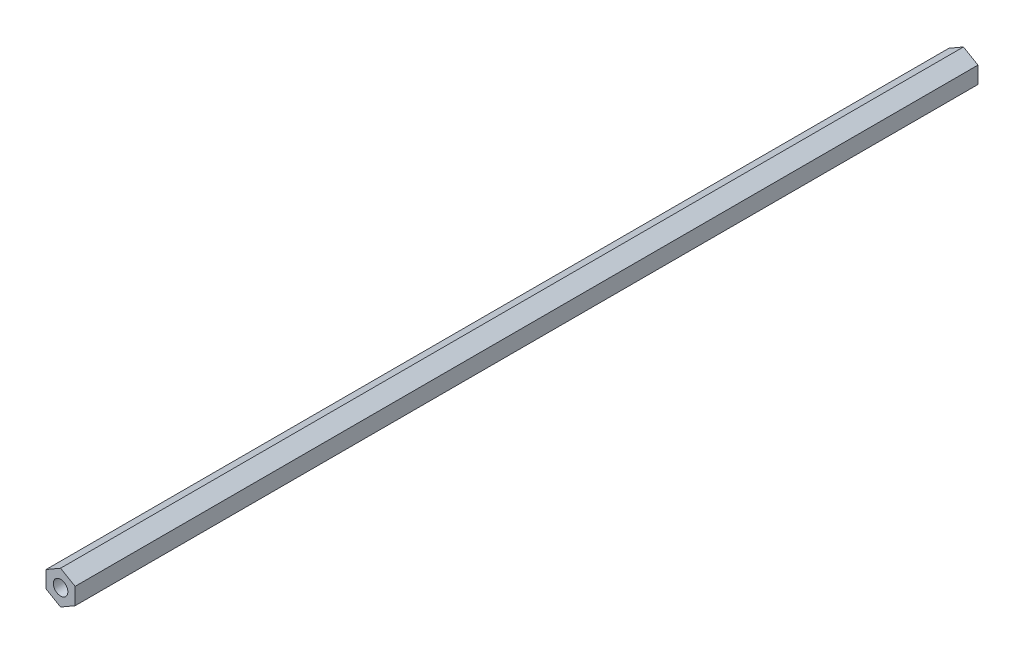
from build123d import *

# Parameters (mm, degrees)
BOSS_EXTRUDE2_DEPTH             = 196.85
BOSS_EXTRUDE2_DEPTH_BACK        = 196.85
F_1_4_0_25_DIAMETER_HOLE1_D     = 6.35
F_1_4_0_25_DIAMETER_HOLE1_DEPTH = 25.4
F_1_4_0_25_DIAMETER_HOLE1_TIP   = 1.907732465
F_1_4_0_25_DIAMETER_HOLE2_D     = 6.35
F_1_4_0_25_DIAMETER_HOLE2_DEPTH = 25.4
F_1_4_0_25_DIAMETER_HOLE2_TIP   = 1.907732465


with BuildPart() as part:
    # Sketch3 → Boss-Extrude2 (new, two sides: drawn at the far end of the back side and taken through both)
    with BuildSketch(Plane.XY.offset(-BOSS_EXTRUDE2_DEPTH_BACK)):
        Polygon((-6.35, -3.666174209), (0, -7.332348419), (6.35, -3.666174209), (6.35, 3.666174209), (0, 7.332348419), (-6.35, 3.666174209), align=None)
    extrude(amount=BOSS_EXTRUDE2_DEPTH + BOSS_EXTRUDE2_DEPTH_BACK)

    # 1/4 (0.25) Diameter Hole1
    with Locations(Plane.XY.offset(196.85)):
        with Locations((0, 0)):
            Hole(F_1_4_0_25_DIAMETER_HOLE1_D / 2, depth=F_1_4_0_25_DIAMETER_HOLE1_DEPTH)
            with Locations((0, 0, -(F_1_4_0_25_DIAMETER_HOLE1_DEPTH + F_1_4_0_25_DIAMETER_HOLE1_TIP / 2))):  # 118° drill point
                Cone(0, F_1_4_0_25_DIAMETER_HOLE1_D / 2, F_1_4_0_25_DIAMETER_HOLE1_TIP, mode=Mode.SUBTRACT)

    # 1/4 (0.25) Diameter Hole2
    with Locations(Plane(origin=(0, 0, -196.85), x_dir=(-1, 0, 0), z_dir=(0, 0, -1))):
        with Locations((0, 0)):
            Hole(F_1_4_0_25_DIAMETER_HOLE2_D / 2, depth=F_1_4_0_25_DIAMETER_HOLE2_DEPTH)
            with Locations((0, 0, -(F_1_4_0_25_DIAMETER_HOLE2_DEPTH + F_1_4_0_25_DIAMETER_HOLE2_TIP / 2))):  # 118° drill point
                Cone(0, F_1_4_0_25_DIAMETER_HOLE2_D / 2, F_1_4_0_25_DIAMETER_HOLE2_TIP, mode=Mode.SUBTRACT)


solid = part.part
